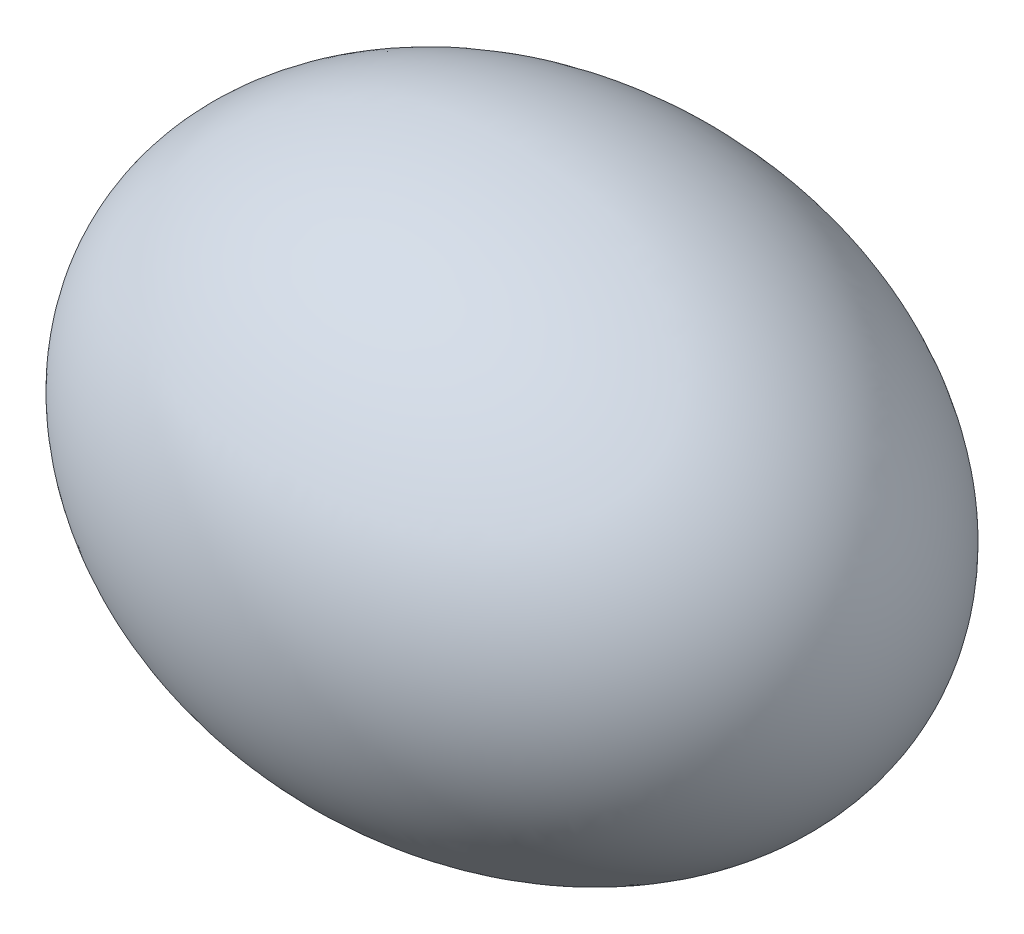
from build123d import *


with BuildPart() as part:
    # Croquis1 → Revolución1 (revolve)
    with BuildSketch(Plane.XY):
        with BuildLine():
            Line((-30, 0), (30, 0))
            add(Edge.make_bspline(
                [(-30, 0), (-30, -22.5), (0, -22.5), (30, -22.5), (30, 0)],
                knots=[3.141592654, 3.141592654, 3.141592654, 4.71238898, 4.71238898, 6.283185307, 6.283185307, 6.283185307], degree=2, weights=[1, 0.707106781, 1, 0.707106781, 1]))
        make_face()
    revolve(axis=Axis((-30, 0, 0), (1, 0, 0)))


solid = part.part
